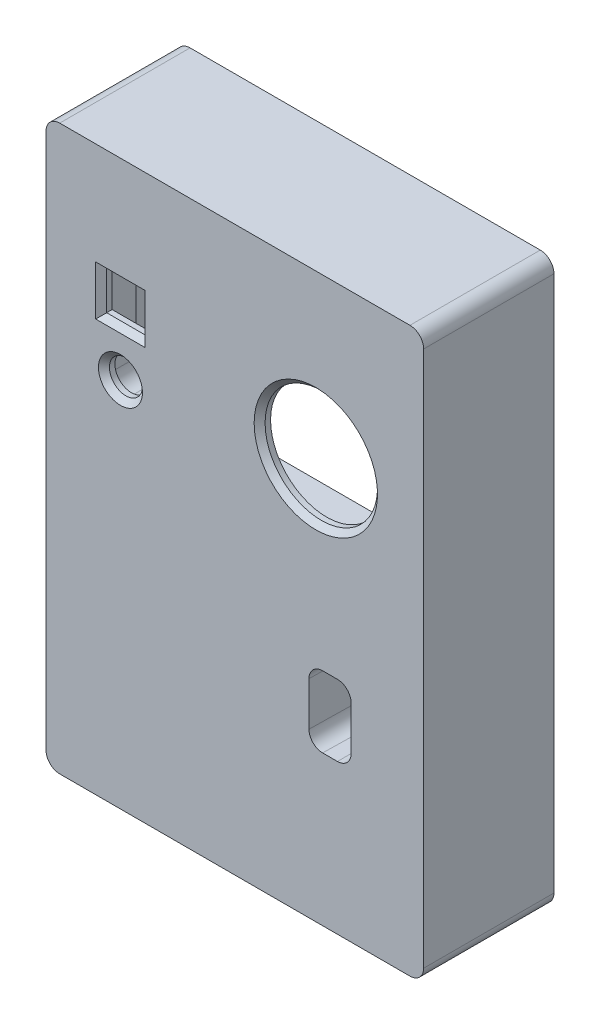
from build123d import *

# Parameters (mm, degrees)
SKETCH2_W            = 69
SKETCH2_H            = 103
BOSS_EXTRUDE1_DEPTH  = 2
SKETCH3_W            = 69
SKETCH3_H            = 103
SKETCH3_W_2          = 65
SKETCH3_H_2          = 99
BOSS_EXTRUDE2_DEPTH  = 21.816
BOSS_EXTRUDE3_DEPTH  = 7.5
SKETCH7_R            = 10.271022242
SKETCH7_R_2          = 3.021022242
SKETCH7_W            = 7.042044484
SKETCH7_H            = 7.042044484
CUT_EXTRUDE1_DEPTH   = 84.899212487
SKETCH9_W            = 1.5
SKETCH9_H            = 6.5
SKETCH9_H_2          = 8.8
BOSS_EXTRUDE4_DEPTH  = 19.69
BOSS_EXTRUDE5_DEPTH  = 21.3
SKETCH10_W           = 10.75
SKETCH10_H           = 4.1
BOSS_EXTRUDE6_DEPTH  = 15.33
BOSS_EXTRUDE7_DEPTH  = 19.69
SKETCH10_6_W         = 5.953168401
SKETCH10_6_H         = 2
BOSS_EXTRUDE8_DEPTH  = 21.3
SKETCH11_W           = 7.5
SKETCH11_H           = 13
CUT_EXTRUDE2_DEPTH   = 84.899212487
FILLET2_R            = 2.5
CHAMFER1_SIZE        = 1
CUT_EXTRUDE3_REACH   = 112.793
SKETCH12_W           = 1
SKETCH12_H           = 11.908
SKETCH13_W           = 11.5
SKETCH13_H           = 17
SKETCH13_W_2         = 7.5
SKETCH13_H_2         = 13
BOSS_EXTRUDE9_DEPTH  = 14.69
SKETCH14_W           = 7.5
SKETCH14_H           = 13
BOSS_EXTRUDE10_DEPTH = 5
DRAFT1_ANGLE         = 1
FILLET3_R            = 2.5
SKETCH15_W           = 4
SKETCH15_H           = 4
BOSS_EXTRUDE11_DEPTH = 0.6
CHAMFER3_SIZE        = 1
CHAMFER3_SIZE2       = 0.577350269
CHAMFER4_SIZE        = 1
CHAMFER4_SIZE2       = 0.577350269
SKETCH16_W           = 2.35
SKETCH16_H           = 3.25
SKETCH16_W_2         = 2.15
SKETCH16_W_3         = 2.25
SKETCH16_H_2         = 2.25
BOSS_EXTRUDE12_DEPTH = 22.8
BOSS_EXTRUDE13_DEPTH = 23.816


with BuildPart() as part:
    # Sketch2 → Boss-Extrude1 (new body)
    with BuildSketch(Plane.XY):
        with Locations((0, -21.8)):
            Rectangle(SKETCH2_W, SKETCH2_H)
    extrude(amount=BOSS_EXTRUDE1_DEPTH)

    # Sketch3 → Boss-Extrude2 (add)
    with BuildSketch(Plane(origin=(0, 0, 0), x_dir=(-1, 0, 0), z_dir=(0, 0, -1))):
        with Locations((0, -21.8)):
            Rectangle(SKETCH3_W, SKETCH3_H)
        with Locations((0, -21.8)):
            Rectangle(SKETCH3_W_2, SKETCH3_H_2, mode=Mode.SUBTRACT)
    extrude(amount=BOSS_EXTRUDE2_DEPTH)

    # Sketch4 → Boss-Extrude3 (add)
    with BuildSketch(Plane(origin=(0, 0, 0), x_dir=(-1, 0, 0), z_dir=(0, 0, -1))):
        with BuildLine():
            Line((29.1, -10), (29.1, -8.439131361))
            Line((29.1, -8.439131361), (29.1, -7.690100036))
            Line((29.1, -7.690100036), (29.1, -6.395046928))
            Line((29.1, -6.395046928), (29.1, -1.888728371))
            Line((29.1, -1.888728371), (29.1, -0.762895346))
            Line((29.1, -0.762895346), (29.1, 3.740436753))
            Line((29.1, 3.740436753), (29.1, 8.676781555))
            Line((29.1, 8.676781555), (29.1, 10))
            ThreePointArc((29.1, 10), (27.840559159, 13.040559159), (24.8, 14.3))
            Line((24.8, 14.3), (16.963486262, 14.3))
            Line((16.963486262, 14.3), (14.426316186, 14.3))
            Line((14.426316186, 14.3), (11.750363034, 14.3))
            Line((11.750363034, 14.3), (8.649377385, 14.3))
            Line((8.649377385, 14.3), (-2.251077026, 14.3))
            Line((-2.251077026, 14.3), (-4.779023688, 14.3))
            Line((-4.779023688, 14.3), (-12.46242881, 14.3))
            Line((-12.46242881, 14.3), (-14.530748807, 14.3))
            Line((-14.530748807, 14.3), (-23.3, 14.3))
            ThreePointArc((-23.3, 14.3), (-27.309567753, 12.690867027), (-29.094332857, 8.756333254))
            ThreePointArc((-29.094332857, 8.756333254), (-29.098583041, 8.628197946), (-29.1, 8.5))
            Line((-29.1, 8.5), (-29.1, 3.740436753))
            Line((-29.1, 3.740436753), (-29.1, -0.762895346))
            Line((-29.1, -0.762895346), (-29.1, -1.888728371))
            Line((-29.1, -1.888728371), (-29.1, -6.395046928))
            Line((-29.1, -6.395046928), (-29.1, -7.690100036))
            Line((-29.1, -7.690100036), (-29.1, -8.439131361))
            Line((-29.1, -8.439131361), (-29.1, -8.5))
            ThreePointArc((-29.1, -8.5), (-28.97231091, -9.710325965), (-28.594865883, -10.867360405))
            ThreePointArc((-28.594865883, -10.867360405), (-26.455099812, -13.366759206), (-23.3, -14.3))
            Line((-23.3, -14.3), (-14.530748807, -14.3))
            Line((-14.530748807, -14.3), (-12.46242881, -14.3))
            Line((-12.46242881, -14.3), (-4.779023688, -14.3))
            Line((-4.779023688, -14.3), (-2.251077026, -14.3))
            Line((-2.251077026, -14.3), (8.649377385, -14.3))
            Line((8.649377385, -14.3), (11.750363034, -14.3))
            Line((11.750363034, -14.3), (14.426316186, -14.3))
            Line((14.426316186, -14.3), (16.963486262, -14.3))
            Line((16.963486262, -14.3), (24.8, -14.3))
            ThreePointArc((24.8, -14.3), (27.758786007, -13.120189956), (29.093941573, -10.228179239))
            ThreePointArc((29.093941573, -10.228179239), (29.098485126, -10.114129827), (29.1, -10))
        make_face()
        with BuildLine():
            Line((24.8, -12.8), (16.963486262, -12.8))
            Line((16.963486262, -12.8), (14.426316186, -12.8))
            Line((14.426316186, -12.8), (11.750363034, -12.8))
            Line((11.750363034, -12.8), (8.649377385, -12.8))
            Line((8.649377385, -12.8), (-2.251077026, -12.8))
            Line((-2.251077026, -12.8), (-4.779023688, -12.8))
            Line((-4.779023688, -12.8), (-12.46242881, -12.8))
            Line((-12.46242881, -12.8), (-14.530748807, -12.8))
            Line((-14.530748807, -12.8), (-23.3, -12.8))
            ThreePointArc((-23.3, -12.8), (-25.639125723, -12.108114584), (-27.225504016, -10.255112024))
            ThreePointArc((-27.225504016, -10.255112024), (-27.505333951, -9.397310629), (-27.6, -8.5))
            Line((-27.6, -8.5), (-27.6, -8.439131361))
            Line((-27.6, -8.439131361), (-27.6, -7.690100036))
            Line((-27.6, -7.690100036), (-27.6, -6.395046928))
            Line((-27.6, -6.395046928), (-27.6, -1.888728371))
            Line((-27.6, -1.888728371), (-27.6, -0.762895346))
            Line((-27.6, -0.762895346), (-27.6, 3.740436753))
            Line((-27.6, 3.740436753), (-27.6, 8.5))
            ThreePointArc((-27.6, 8.5), (-27.598949496, 8.595043305), (-27.595798498, 8.690040171))
            ThreePointArc((-27.595798498, 8.690040171), (-26.272610575, 11.607022106), (-23.3, 12.8))
            Line((-23.3, 12.8), (-14.530748807, 12.8))
            Line((-14.530748807, 12.8), (-12.46242881, 12.8))
            Line((-12.46242881, 12.8), (-4.779023688, 12.8))
            Line((-4.779023688, 12.8), (-2.251077026, 12.8))
            Line((-2.251077026, 12.8), (8.649377385, 12.8))
            Line((8.649377385, 12.8), (11.750363034, 12.8))
            Line((11.750363034, 12.8), (14.426316186, 12.8))
            Line((14.426316186, 12.8), (16.963486262, 12.8))
            Line((16.963486262, 12.8), (24.8, 12.8))
            ThreePointArc((24.8, 12.8), (26.779898987, 11.979898987), (27.6, 10))
            Line((27.6, 10), (27.6, 8.676781555))
            Line((27.6, 8.676781555), (27.6, 3.740436753))
            Line((27.6, 3.740436753), (27.6, -0.762895346))
            Line((27.6, -0.762895346), (27.6, -1.888728371))
            Line((27.6, -1.888728371), (27.6, -6.395046928))
            Line((27.6, -6.395046928), (27.6, -7.690100036))
            Line((27.6, -7.690100036), (27.6, -8.439131361))
            Line((27.6, -8.439131361), (27.6, -10))
            ThreePointArc((27.6, -10), (27.599013571, -10.074317097), (27.596054978, -10.14858183))
            ThreePointArc((27.596054978, -10.14858183), (26.726651354, -12.031751599), (24.8, -12.8))
        make_face(mode=Mode.SUBTRACT)
    extrude(amount=BOSS_EXTRUDE3_DEPTH)

    # Sketch7 → Cut-Extrude1 (cut, through all)
    with BuildSketch(Plane(origin=(0, 0, 0), x_dir=(-1, 0, 0), z_dir=(0, 0, -1))):
        with Locations((-14.8, 0)):
            Circle(SKETCH7_R)
        with Locations((20.9, -5.4)):
            Circle(SKETCH7_R_2)
        with Locations((20.9, 6.5)):
            Rectangle(SKETCH7_W, SKETCH7_H)
    extrude(amount=-CUT_EXTRUDE1_DEPTH, mode=Mode.SUBTRACT)

    # Sketch9 → Boss-Extrude4 (add)
    with BuildSketch(Plane(origin=(0, 0, 0), x_dir=(-1, 0, 0), z_dir=(0, 0, -1))):
        with Locations((-21.85, -64.55)):
            Rectangle(SKETCH9_W, SKETCH9_H)
        with Locations((21.65, -63.4)):
            Rectangle(SKETCH9_W, SKETCH9_H_2)
    extrude(amount=BOSS_EXTRUDE4_DEPTH)

    # Sketch9<4> → Boss-Extrude5 (add)
    with BuildSketch(Plane(origin=(0, 0, 0), x_dir=(-1, 0, 0), z_dir=(0, 0, -1))):
        Polygon((-24.6, -61.3), (-24.6, -71.3), (-21.1, -71.3), (-21.1, -67.8), (-22.6, -67.8), (-22.6, -61.3), align=None)
        Polygon((20.9, -69.8), (24.4, -69.8), (24.4, -59), (22.4, -59), (22.4, -67.8), (20.9, -67.8), align=None)
    extrude(amount=BOSS_EXTRUDE5_DEPTH)

    # Sketch10 → Boss-Extrude6 (add)
    with BuildSketch(Plane(origin=(0, 0, 0), x_dir=(-1, 0, 0), z_dir=(0, 0, -1))):
        with Locations((16, -35.6625)):
            Rectangle(SKETCH10_W, SKETCH10_H)
    extrude(amount=BOSS_EXTRUDE6_DEPTH)

    # Sketch10<4> → Boss-Extrude7 (add)
    with BuildSketch(Plane(origin=(0, 0, 0), x_dir=(-1, 0, 0), z_dir=(0, 0, -1))):
        Polygon((21.375, -37.7125), (22.4, -37.7125), (22.4, -32.8), (21.375, -32.8), (21.375, -33.6125), align=None)
        Polygon((4.671831599, -37.7125), (10.625, -37.7125), (10.625, -33.6125), (10.625, -32.8), (4.671831599, -32.8), align=None)
    extrude(amount=BOSS_EXTRUDE7_DEPTH)

    # Sketch10<6> → Boss-Extrude8 (add)
    with BuildSketch(Plane(origin=(0, 0, 0), x_dir=(-1, 0, 0), z_dir=(0, 0, -1))):
        with Locations((7.6484158, -31.8)):
            Rectangle(SKETCH10_6_W, SKETCH10_6_H)
        Polygon((22.4, -37.7125), (22.4, -45.8), (24.4, -45.8), (24.4, -30.8), (21.375, -30.8), (21.375, -32.8), (22.4, -32.8), align=None)
    extrude(amount=BOSS_EXTRUDE8_DEPTH)

    # Sketch11 → Cut-Extrude2 (cut, through all)
    with BuildSketch(Plane(origin=(0, 0, 0), x_dir=(-1, 0, 0), z_dir=(0, 0, -1))):
        with Locations((-17.5, -39.45)):
            Rectangle(SKETCH11_W, SKETCH11_H)
    extrude(amount=-CUT_EXTRUDE2_DEPTH, mode=Mode.SUBTRACT)

    # Fillet2
    fillet2_edges = [part.edges().sort_by_distance(p)[0] for p in [
        (-34.5, 29.7, -9.908),
        (34.5, 29.7, -9.908),
        (34.5, -73.3, -9.908),
        (-34.5, -73.3, -9.908),
    ]]
    fillet(fillet2_edges, radius=FILLET2_R)

    # Chamfer1
    chamfer1_edges = [part.edges().sort_by_distance(p)[0] for p in [
        (25.071022242, 0, 2),
        (-17.878977758, -5.4, 2),
        (-24.421022242, 6.5, 2),
        (-20.9, 2.978977758, 2),
        (-17.378977758, 6.5, 2),
        (-20.9, 10.021022242, 2),
    ]]
    chamfer(chamfer1_edges, length=CHAMFER1_SIZE)

    # Sketch12 → Cut-Extrude3 (cut, up to next)
    with BuildSketch(Plane.XZ.offset(73.3), mode=Mode.PRIVATE) as cut_extrude3_sk1:
        with Locations((-23.360094853, -15.862)):
            Rectangle(SKETCH12_W, SKETCH12_H)
    cut_extrude3_tool1 = extrude(cut_extrude3_sk1.sketch, amount=-CUT_EXTRUDE3_REACH, mode=Mode.PRIVATE) & part.part
    # Sketch12 → Cut-Extrude3 (cut, up to next)
    with BuildSketch(Plane.XZ.offset(73.3), mode=Mode.PRIVATE) as cut_extrude3_sk2:
        with Locations((-12.360094853, -15.862)):
            Rectangle(SKETCH12_W, SKETCH12_H)
    cut_extrude3_tool2 = extrude(cut_extrude3_sk2.sketch, amount=-CUT_EXTRUDE3_REACH, mode=Mode.PRIVATE) & part.part
    add(cut_extrude3_tool1.solids().sort_by_distance((-23.360095, -73.3, -15.862))[0], mode=Mode.SUBTRACT)
    add(cut_extrude3_tool2.solids().sort_by_distance((-12.360095, -73.3, -15.862))[0], mode=Mode.SUBTRACT)

    # Sketch13 → Boss-Extrude9 (add)
    with BuildSketch(Plane(origin=(0, 0, 0), x_dir=(-1, 0, 0), z_dir=(0, 0, -1))):
        with Locations((-17.5, -39.45)):
            Rectangle(SKETCH13_W, SKETCH13_H)
        with Locations((-17.5, -39.45)):
            Rectangle(SKETCH13_W_2, SKETCH13_H_2, mode=Mode.SUBTRACT)
    extrude(amount=BOSS_EXTRUDE9_DEPTH)

    # Sketch14 → Boss-Extrude10 (add)
    # profile 1 of 2: a face of its own
    with BuildSketch(Plane(origin=(0, 0, -14.69), x_dir=(-1, 0, 0), z_dir=(0, 0, -1))):
        with Locations((-17.5, -39.45)):
            Rectangle(SKETCH14_W, SKETCH14_H)
        with BuildLine():
            Line((-17.22, -34.88), (-17.78, -34.88))
            ThreePointArc((-17.78, -34.88), (-18.769949494, -35.290050506), (-19.18, -36.28))
            Line((-19.18, -36.28), (-19.18, -42.62))
            ThreePointArc((-19.18, -42.62), (-18.769949494, -43.609949494), (-17.78, -44.02))
            Line((-17.78, -44.02), (-17.22, -44.02))
            ThreePointArc((-17.22, -44.02), (-16.230050506, -43.609949494), (-15.82, -42.62))
            Line((-15.82, -42.62), (-15.82, -36.28))
            ThreePointArc((-15.82, -36.28), (-16.230050506, -35.290050506), (-17.22, -34.88))
        make_face(mode=Mode.SUBTRACT)
    # profile 2 of 2: a face of its own
    with BuildSketch(Plane(origin=(0, 0, -14.69), x_dir=(-1, 0, 0), z_dir=(0, 0, -1))):
        with BuildLine():
            Line((-17.22, -34.98), (-17.78, -34.98))
            ThreePointArc((-17.78, -34.98), (-18.699238816, -35.360761184), (-19.08, -36.28))
            Line((-19.08, -36.28), (-19.08, -42.62))
            ThreePointArc((-19.08, -42.62), (-18.699238816, -43.539238816), (-17.78, -43.92))
            Line((-17.78, -43.92), (-17.22, -43.92))
            ThreePointArc((-17.22, -43.92), (-16.300761184, -43.539238816), (-15.92, -42.62))
            Line((-15.92, -42.62), (-15.92, -36.28))
            ThreePointArc((-15.92, -36.28), (-16.300761184, -35.360761184), (-17.22, -34.98))
        make_face()
    extrude(amount=-BOSS_EXTRUDE10_DEPTH)


with BuildPart() as boss_extrude10_kept_piece:
    # of the separate pieces the step leaves, the one the design keeps (boss_extrude10_pieces_kept)
    add(part.part.solids().sort_by_distance((3.528977758, 0, 2))[0])

    # Draft1
    draft1_faces = [boss_extrude10_kept_piece.faces().sort_by_distance(p)[0] for p in [
        (13.75, -39.45, -3.845),
    ]]
    draft(draft1_faces, Plane.XY.offset(-9.69), DRAFT1_ANGLE)

    # Fillet3
    fillet3_edges = [boss_extrude10_kept_piece.edges().sort_by_distance(p)[0] for p in [
        (13.647975145, -32.95, -3.845),
        (13.647975145, -45.95, -3.845),
        (21.25, -45.95, -3.845),
        (21.25, -32.95, -3.845),
    ]]
    fillet(fillet3_edges, radius=FILLET3_R)

    # Sketch15 → Boss-Extrude11 (add)
    with BuildSketch(Plane(origin=(0, -71.3, 0), x_dir=(1, 0, 0), z_dir=(0, 1, 0))):
        with Locations((-18.17, 17.955)):
            Rectangle(SKETCH15_W, SKETCH15_H)
    extrude(amount=BOSS_EXTRUDE11_DEPTH)

    # Chamfer3
    chamfer3_edges = [boss_extrude10_kept_piece.edges().sort_by_distance(p)[0] for p in [
        (-18.17, -71.3, -15.955),
    ]]
    chamfer3_side = [boss_extrude10_kept_piece.faces().sort_by_distance(p)[0] for p in [
        (-0.757391404, -71.3, -10.745764223),
    ]]
    chamfer(chamfer3_edges, length=CHAMFER3_SIZE, length2=CHAMFER3_SIZE2, reference=chamfer3_side[0])

    # Chamfer4
    chamfer4_edges = [boss_extrude10_kept_piece.edges().sort_by_distance(p)[0] for p in [
        (-18.17, -71.3, -19.955),
    ]]
    chamfer4_side = [boss_extrude10_kept_piece.faces().sort_by_distance(p)[0] for p in [
        (-0.703800708, -71.3, -10.731270632),
    ]]
    chamfer(chamfer4_edges, length=CHAMFER4_SIZE, length2=CHAMFER4_SIZE2, reference=chamfer4_side[0])

    # Sketch16 → Boss-Extrude12 (add)
    with BuildSketch(Plane(origin=(0, 0, 0), x_dir=(-1, 0, 0), z_dir=(0, 0, -1))):
        with Locations((25.575, -69.425)):
            Rectangle(SKETCH16_W, SKETCH16_H)
        with Locations((-25.675, -69.425)):
            Rectangle(SKETCH16_W_2, SKETCH16_H)
        with Locations((25.625, 21.325)):
            Rectangle(SKETCH16_W_3, SKETCH16_H_2)
        with Locations((-25.625, 21.325)):
            Rectangle(SKETCH16_W_3, SKETCH16_H_2)
    extrude(amount=BOSS_EXTRUDE12_DEPTH)

    # Sketch16<4> → Boss-Extrude13 (add)
    with BuildSketch(Plane(origin=(0, 0, 0), x_dir=(-1, 0, 0), z_dir=(0, 0, -1))):
        Polygon((28, -67.8), (26.75, -67.8), (26.75, -71.05), (24.4, -71.05), (24.4, -71.3), (28, -71.3), align=None)
        Polygon((-26.75, -71.05), (-26.75, -67.8), (-28, -67.8), (-28, -71.3), (-24.6, -71.3), (-24.6, -71.05), align=None)
        Polygon((28.5, 20.2), (28.5, 24.2), (24.5, 24.2), (24.5, 22.45), (26.75, 22.45), (26.75, 20.2), align=None)
        Polygon((-24.5, 22.45), (-24.5, 24.2), (-28.5, 24.2), (-28.5, 20.2), (-26.75, 20.2), (-26.75, 22.45), align=None)
    extrude(amount=BOSS_EXTRUDE13_DEPTH)


solid = boss_extrude10_kept_piece.part
